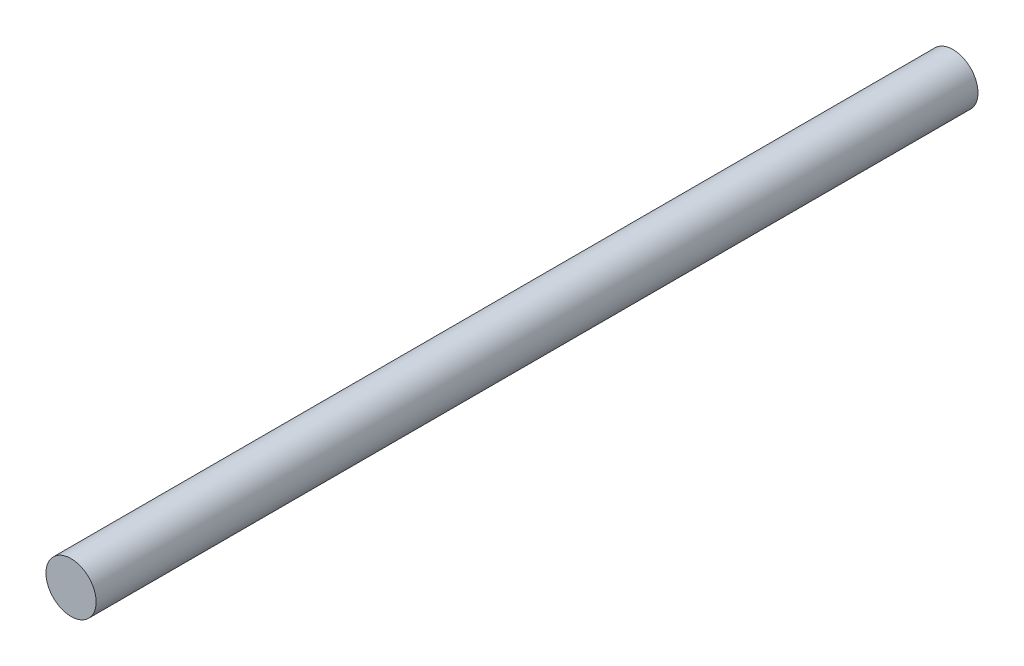
from build123d import *

# Parameters (mm, degrees)
SKETCH_1_R        = 1.5
EXTRUDE_203_DEPTH = 52.75


with BuildPart() as part:
    # 草图1 → Extrude 203 (new body)
    with BuildSketch(Plane.XY):
        Circle(SKETCH_1_R)
    extrude(amount=EXTRUDE_203_DEPTH)


solid = part.part
